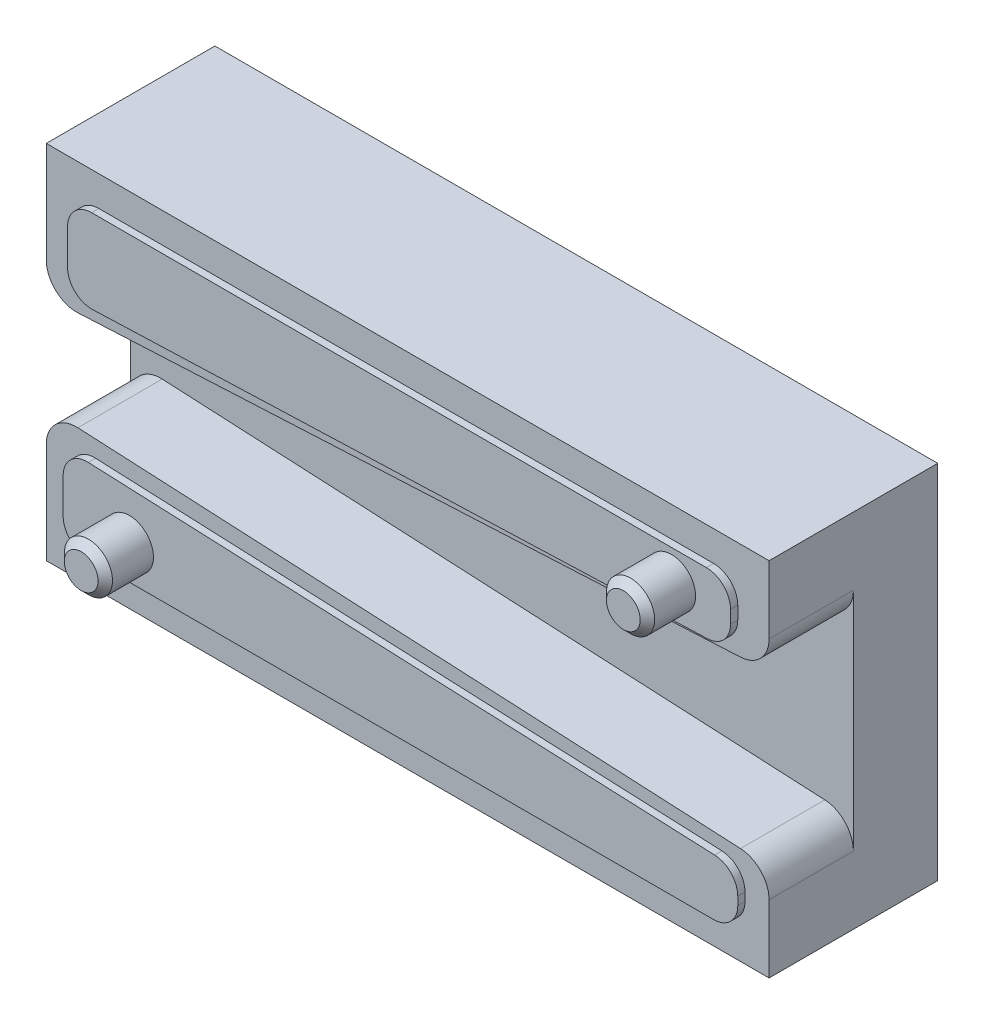
from build123d import *

# Parameters (mm, degrees)
SKETCH1_W           = 76.2
SKETCH1_H           = 38.1
BOSS_EXTRUDE1_DEPTH = 17.78
CUT_EXTRUDE1_DEPTH  = 8.89
FILLET1_R           = 3.175
SKETCH3_R           = 2.54
BOSS_EXTRUDE2_DEPTH = 5.842
CHAMFER1_SIZE       = 0.762
BOSS_EXTRUDE3_DEPTH = 0.762
FILLET2_R           = 2.54
BOSS_EXTRUDE4_DEPTH = 0.762
FILLET3_R           = 2.54


with BuildPart() as part:
    # Sketch1 → Boss-Extrude1 (new body)
    with BuildSketch(Plane.XY):
        with Locations((-38.1, -19.05)):
            Rectangle(SKETCH1_W, SKETCH1_H)
    extrude(amount=BOSS_EXTRUDE1_DEPTH)

    # Sketch2 → Cut-Extrude1 (cut)
    with BuildSketch(Plane.XY.offset(17.78)):
        Polygon((-76.2, -24.13), (-76.2, -13.97), (0, -10.16), (0, -27.94), align=None)
    extrude(amount=-CUT_EXTRUDE1_DEPTH, mode=Mode.SUBTRACT)

    # Fillet1
    fillet1_edges = [part.edges().sort_by_distance(p)[0] for p in [
        (-76.2, -13.97, 13.335),
        (0, -10.16, 13.335),
        (0, -27.94, 13.335),
        (-76.2, -24.13, 13.335),
    ]]
    fillet(fillet1_edges, radius=FILLET1_R)

    # Sketch3 → Boss-Extrude2 (add)
    with BuildSketch(Plane.XY.offset(17.78)):
        with Locations(Location((-9.525, -6.35, 0), (0, 0, 180))):
            Circle(SKETCH3_R)
        with Locations(Location((-66.675, -31.369, 0), (0, 0, 180))):
            Circle(SKETCH3_R)
    extrude(amount=BOSS_EXTRUDE2_DEPTH)

    # Chamfer1
    chamfer1_edges = [part.edges().sort_by_distance(p)[0] for p in [
        (-6.985, -6.35, 23.622),
        (-64.135, -31.369, 23.622),
    ]]
    chamfer(chamfer1_edges, length=CHAMFER1_SIZE)

    # Sketch4 → Boss-Extrude3 (add)
    with BuildSketch(Plane.XY.offset(17.78)):
        Polygon((-73.66, -26.035), (-2.54, -29.083), (-2.54, -34.925), (-73.66, -34.925), align=None)
    extrude(amount=BOSS_EXTRUDE3_DEPTH)

    # Fillet2
    fillet2_edges = [part.edges().sort_by_distance(p)[0] for p in [
        (-73.66, -26.035, 18.161),
        (-73.66, -34.925, 18.161),
        (-2.54, -34.925, 18.161),
        (-2.54, -29.083, 18.161),
    ]]
    fillet(fillet2_edges, radius=FILLET2_R)

    # Sketch5 → Boss-Extrude4 (add)
    with BuildSketch(Plane.XY.offset(17.78)):
        Polygon((-73.192591087, -3.175), (-3.302, -3.175), (-3.302, -9.525), (-73.192591087, -12.065), align=None)
    extrude(amount=BOSS_EXTRUDE4_DEPTH)

    # Fillet3
    fillet3_edges = [part.edges().sort_by_distance(p)[0] for p in [
        (-73.192591087, -3.175, 18.161),
        (-73.192591087, -12.065, 18.161),
        (-3.302, -9.525, 18.161),
        (-3.302, -3.175, 18.161),
    ]]
    fillet(fillet3_edges, radius=FILLET3_R)


solid = part.part
